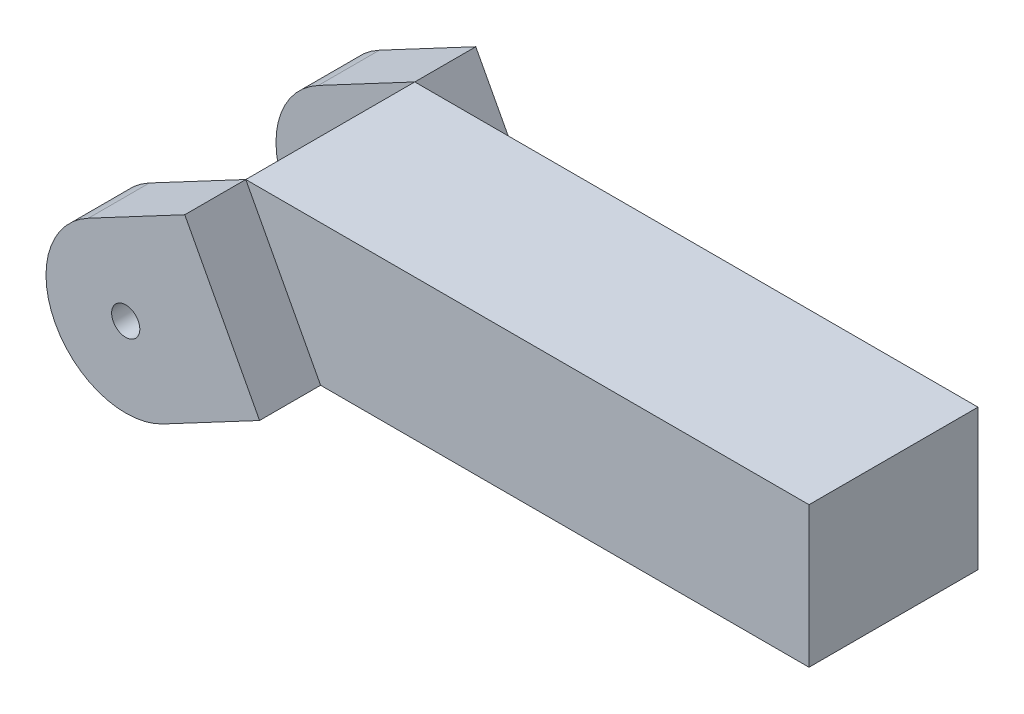
from build123d import *

# Parameters (mm, degrees)
SKETCH_1_W          = 120
SKETCH_1_H          = 30
EXTRUDE_1_DEPTH     = 36
SKETCH_2_W          = 41
SKETCH_2_H          = 21
CUT_EXTRUDE_1_DEPTH = 30
EXTRUDE_START       = -13
SKETCH_4_R          = 3
EXTRUDE_2_DEPTH     = 13
SKETCH_6_W          = 23.268382573
SKETCH_6_H          = 36
CUT_EXTRUDE_2_DEPTH = 105.8740742


with BuildPart() as part:
    # 草图1 → 凸台-拉伸1 (new body)
    with BuildSketch(Plane.XY):
        Rectangle(SKETCH_1_W, SKETCH_1_H)
    extrude(amount=EXTRUDE_1_DEPTH)

    # 草图2 → 切除-拉伸1 (cut)
    with BuildSketch(Plane(origin=(0, 0, 0), x_dir=(-1, 0, 0), z_dir=(0, 0, -1))):
        with Locations((-34.5, -0.5)):
            Rectangle(SKETCH_2_W, SKETCH_2_H)
    extrude(amount=-CUT_EXTRUDE_1_DEPTH, mode=Mode.SUBTRACT)

    # 草图4 → 凸台-拉伸2 (add)
    with BuildSketch(Plane(origin=(0, 0, -13), x_dir=(-1, 0, 0), z_dir=(0, 0, -1)).offset(EXTRUDE_START)):
        with BuildLine():
            Line((60, 15), (44.063500094, -15))
            Line((44.063500094, -15), (64.612458324, -25.91594903))
            ThreePointArc((64.612458324, -25.91594903), (87.580708277, -18.884198983), (80.54895823, 4.08405097))
            Line((80.54895823, 4.08405097), (60, 15))
        make_face()
        with Locations((72.580708277, -10.91594903)):
            Circle(SKETCH_4_R, mode=Mode.SUBTRACT)
    extrude(amount=EXTRUDE_2_DEPTH)


with BuildPart() as body_2:
    # 镜向5: mirrored copy
    add(part.part.mirror(Plane(origin=(0, 0, 18), x_dir=(1, 0, 0), z_dir=(0, 0, -1))))


with BuildPart() as cut_extrude_2_tool:
    # 草图6 → 切除-拉伸2 (new, through all)
    with BuildSketch(Plane(origin=(-3.483162049, 6.556951782, 0), x_dir=(0.8831279168378943, 0.46913226546631975, 0), z_dir=(0.4691322654663197, -0.8831279168378942, 0))):
        with Locations((-57.584882315, 18)):
            Rectangle(SKETCH_6_W, SKETCH_6_H)
    extrude(amount=-CUT_EXTRUDE_2_DEPTH)


with BuildPart() as part_1:
    add(part.part)

    # 切除-拉伸2: cut by cut_extrude_2_tool
    add(cut_extrude_2_tool.part, mode=Mode.SUBTRACT)


with BuildPart() as body_2_1:
    add(body_2.part)

    # 切除-拉伸2: cut by cut_extrude_2_tool
    add(cut_extrude_2_tool.part, mode=Mode.SUBTRACT)


with BuildPart() as cut_extrude_2_piece_1:
    # of the separate pieces the step leaves, piece 1, a body of its own (cut_extrude_2_pieces)
    add(part_1.part.solids().sort_by_distance((-60, 15, 36))[0])


with BuildPart() as cut_extrude_2_piece_2:
    # of the separate pieces the step leaves, piece 2, a body of its own (cut_extrude_2_pieces)
    add(part_1.part.solids().sort_by_distance((-64.612458324, -25.91594903, 0))[0])


with BuildPart() as cut_extrude_2_piece_1_of_body_2:
    # of the separate pieces the step leaves, piece 1, a body of its own (cut_extrude_2_pieces_of_body_2)
    add(body_2_1.part.solids().sort_by_distance((-60, 15, 0))[0])


with BuildPart() as cut_extrude_2_piece_2_of_body_2:
    # of the separate pieces the step leaves, piece 2, a body of its own (cut_extrude_2_pieces_of_body_2)
    add(body_2_1.part.solids().sort_by_distance((-64.612458324, -25.91594903, 36))[0])


solid = Compound([cut_extrude_2_piece_1.part, cut_extrude_2_piece_2.part, cut_extrude_2_piece_1_of_body_2.part, cut_extrude_2_piece_2_of_body_2.part])
